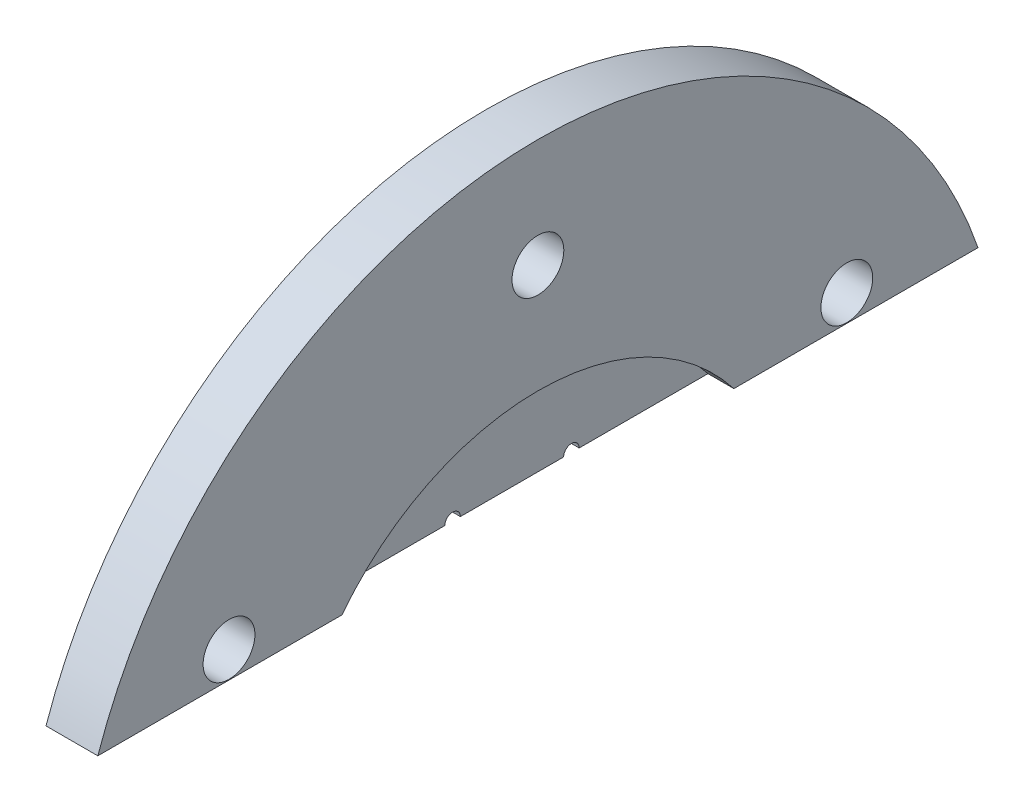
from build123d import *

# Parameters (mm, degrees)
SKETCH1_R                   = 89.825
SKETCH1_R_2                 = 47.825
BOSS_EXTRUDE1_DEPTH         = 10
SKETCH3_R                   = 47.825
TBH_IDK_DEPTH               = 5
EXTRUSION_START             = 5
SKETCH4_R                   = 47.825
EXTRUSION_TO_FUEL_MAN_DEPTH = 5
OX_DOWNCOMER_REACH          = 129.914
OX_PROFILE_R                = 1.5
OX_ORIFICES_COUNT           = 3
SKETCH7_R                   = 47.825
FUEL_BLOCKERS_DEPTH         = 5
SKETCH8_R                   = 25.085
TI_CUT_EXTRUDE_DEPTH        = 128.424727781
SKETCH9_R                   = 51.325
FUEL_VOLUME_DEPTH           = 2
SKETCH10_R                  = 5
CUT_EXTRUDE1_DEPTH          = 128.91427305
SKETCH12_W                  = 10
SKETCH12_H                  = 179.65
CUT_EXTRUDE2_DEPTH          = 150.516390415


with BuildPart() as part:
    # Sketch1 → Boss-Extrude1 (new body)
    with BuildSketch(Plane(origin=(0, 0, 0), x_dir=(0, 0, -1), z_dir=(1, 0, 0))):
        Circle(SKETCH1_R)
        Circle(SKETCH1_R_2, mode=Mode.SUBTRACT)
    extrude(amount=BOSS_EXTRUDE1_DEPTH)

    # Sketch3 → tbh idk (add)
    with BuildSketch(Plane.ZY):
        Circle(SKETCH3_R)
    extrude(amount=-TBH_IDK_DEPTH)

    # Sketch4 → Extrusion to Fuel Man (add)
    with BuildSketch(Plane.ZY.offset(EXTRUSION_START)):
        Circle(SKETCH4_R)
    extrude(amount=-EXTRUSION_TO_FUEL_MAN_DEPTH)

    # Ox Profile → Ox Downcomer (cut, up to next)
    with BuildSketch(Plane.ZY.offset(5), mode=Mode.PRIVATE) as ox_downcomer_sk1:
        with Locations((11.464101615, 29.2826)):
            Circle(OX_PROFILE_R)
    ox_downcomer_tool1 = extrude(ox_downcomer_sk1.sketch, amount=-OX_DOWNCOMER_REACH, mode=Mode.PRIVATE) & part.part
    # Ox Profile → Ox Downcomer (cut, up to next)
    with BuildSketch(Plane.ZY.offset(5), mode=Mode.PRIVATE) as ox_downcomer_sk2:
        with Locations((-11.464101615, 29.2826)):
            Circle(OX_PROFILE_R)
    ox_downcomer_tool2 = extrude(ox_downcomer_sk2.sketch, amount=-OX_DOWNCOMER_REACH, mode=Mode.PRIVATE) & part.part
    ox_downcomer_1 = ox_downcomer_tool1.solids().sort_by_distance((-5, 29.2826, 11.464102))[0]
    add(ox_downcomer_1, mode=Mode.SUBTRACT)
    ox_downcomer_2 = ox_downcomer_tool2.solids().sort_by_distance((-5, 29.2826, -11.464102))[0]
    add(ox_downcomer_2, mode=Mode.SUBTRACT)
    ox_downcomer = ox_downcomer_1 + ox_downcomer_2  # Ox Downcomer as one shape, for the pattern or mirror that repeats it

    # Ox Orifices: Ox Downcomer ×3 about axis
    ox_orifices_axis = Axis((0, -0.057725471, 0), (1, 0, 0))
    for i in range(1, OX_ORIFICES_COUNT):
        add(ox_downcomer.rotate(ox_orifices_axis, i * 360 / OX_ORIFICES_COUNT), mode=Mode.SUBTRACT)

    # Sketch7 → Fuel Blockers (cut)
    with BuildSketch(Plane.ZY.offset(5)):
        Circle(SKETCH7_R)
        with BuildLine():
            Line((-34.988640613, -2.46309677), (-15.361215932, 31.5326))
            ThreePointArc((-15.361215932, 31.5326), (-10.299415912, 33.629266218), (-6.964101615, 29.2826))
            ThreePointArc((-6.964101615, 29.2826), (0, 22.318498385), (6.964101615, 29.2826))
            ThreePointArc((6.964101615, 29.2826), (10.299415912, 33.629266218), (15.361215932, 31.5326))
            Line((15.361215932, 31.5326), (34.988640613, -2.46309677))
            ThreePointArc((34.988640613, -2.46309677), (34.273506812, -7.895077285), (28.841526296, -8.610211087))
            ThreePointArc((28.841526296, -8.610211087), (19.328386576, -11.159249192), (21.877424681, -20.672388913))
            ThreePointArc((21.877424681, -20.672388913), (23.9740909, -25.734188933), (19.627424681, -29.06950323))
            Line((19.627424681, -29.06950323), (-19.627424681, -29.06950323))
            ThreePointArc((-19.627424681, -29.06950323), (-23.9740909, -25.734188933), (-21.877424681, -20.672388913))
            ThreePointArc((-21.877424681, -20.672388913), (-19.328386576, -11.159249192), (-28.841526296, -8.610211087))
            ThreePointArc((-28.841526296, -8.610211087), (-34.273506812, -7.895077285), (-34.988640613, -2.46309677))
        make_face(mode=Mode.SUBTRACT)
    extrude(amount=-FUEL_BLOCKERS_DEPTH, mode=Mode.SUBTRACT)

    # Sketch8 → TI Cut Extrude (cut, through all)
    with BuildSketch(Plane(origin=(5, 0, 0), x_dir=(0, 0, -1), z_dir=(1, 0, 0))):
        Circle(SKETCH8_R)
    extrude(amount=-TI_CUT_EXTRUDE_DEPTH, mode=Mode.SUBTRACT)

    # Sketch9 → Fuel Volume (cut)
    with BuildSketch(Plane.ZY):
        Circle(SKETCH9_R)
        with BuildLine():
            ThreePointArc((-15.361215932, 31.5326), (-10.299415912, 33.629266218), (-6.964101615, 29.2826))
            ThreePointArc((-6.964101615, 29.2826), (-6.485666055, 26.745899952), (-5.116096664, 24.557743787))
            ThreePointArc((-5.116096664, 24.557743787), (0, 25.085), (5.116096664, 24.557743787))
            ThreePointArc((5.116096664, 24.557743787), (6.485666055, 26.745899952), (6.964101615, 29.2826))
            ThreePointArc((6.964101615, 29.2826), (10.299415912, 33.629266218), (15.361215932, 31.5326))
            Line((15.361215932, 31.5326), (34.988640613, -2.46309677))
            ThreePointArc((34.988640613, -2.46309677), (34.273506812, -7.895077285), (28.841526296, -8.610211087))
            ThreePointArc((28.841526296, -8.610211087), (26.405461833, -7.756198412), (23.825678311, -7.848202214))
            ThreePointArc((23.825678311, -7.848202214), (21.724247254, -12.5425), (18.709581647, -16.709541573))
            ThreePointArc((18.709581647, -16.709541573), (19.919795778, -18.98970154), (21.877424681, -20.672388913))
            ThreePointArc((21.877424681, -20.672388913), (23.9740909, -25.734188933), (19.627424681, -29.06950323))
            Line((19.627424681, -29.06950323), (-19.627424681, -29.06950323))
            ThreePointArc((-19.627424681, -29.06950323), (-23.9740909, -25.734188933), (-21.877424681, -20.672388913))
            ThreePointArc((-21.877424681, -20.672388913), (-19.919795778, -18.98970154), (-18.709581647, -16.709541573))
            ThreePointArc((-18.709581647, -16.709541573), (-21.724247254, -12.5425), (-23.825678311, -7.848202214))
            ThreePointArc((-23.825678311, -7.848202214), (-26.405461833, -7.756198412), (-28.841526296, -8.610211087))
            ThreePointArc((-28.841526296, -8.610211087), (-34.273506812, -7.895077285), (-34.988640613, -2.46309677))
            Line((-34.988640613, -2.46309677), (-15.361215932, 31.5326))
        make_face(mode=Mode.SUBTRACT)
    extrude(amount=-FUEL_VOLUME_DEPTH, mode=Mode.SUBTRACT)

    # Sketch10 → Cut-Extrude1 (cut, through all)
    with BuildSketch(Plane(origin=(10, 0, 0), x_dir=(0, 0, -1), z_dir=(1, 0, 0))):
        with Locations((0, 68.825)):
            Circle(SKETCH10_R)
        with Locations((59.604198415, 34.4125)):
            Circle(SKETCH10_R)
        with Locations((59.604198415, -34.4125)):
            Circle(SKETCH10_R)
        with Locations((0, -68.825)):
            Circle(SKETCH10_R)
        with Locations((-59.604198415, -34.4125)):
            Circle(SKETCH10_R)
        with Locations((-59.604198415, 34.4125)):
            Circle(SKETCH10_R)
    extrude(amount=-CUT_EXTRUDE1_DEPTH, mode=Mode.SUBTRACT)

    # Sketch12 → Cut-Extrude2 (cut, through all)
    with BuildSketch(Plane(origin=(0, 29.2826, 0), x_dir=(1, 0, 0), z_dir=(0, 1, 0))):
        with Locations((5, 0)):
            Rectangle(SKETCH12_W, SKETCH12_H)
        Polygon((-5, -34.988640613), (-5, -35.591526296), (0, -35.591526296), (0, 35.591526296), (-5, 35.591526296), (-5, 34.988640613), (-5, 28.841526296), (-5, 18.709581647), (-5, 15.361215932), (-5, -6.964101615), (-5, -15.361215932), (-5, -18.709581647), (-5, -28.841526296), align=None)
    extrude(amount=-CUT_EXTRUDE2_DEPTH, mode=Mode.SUBTRACT)


solid = part.part
